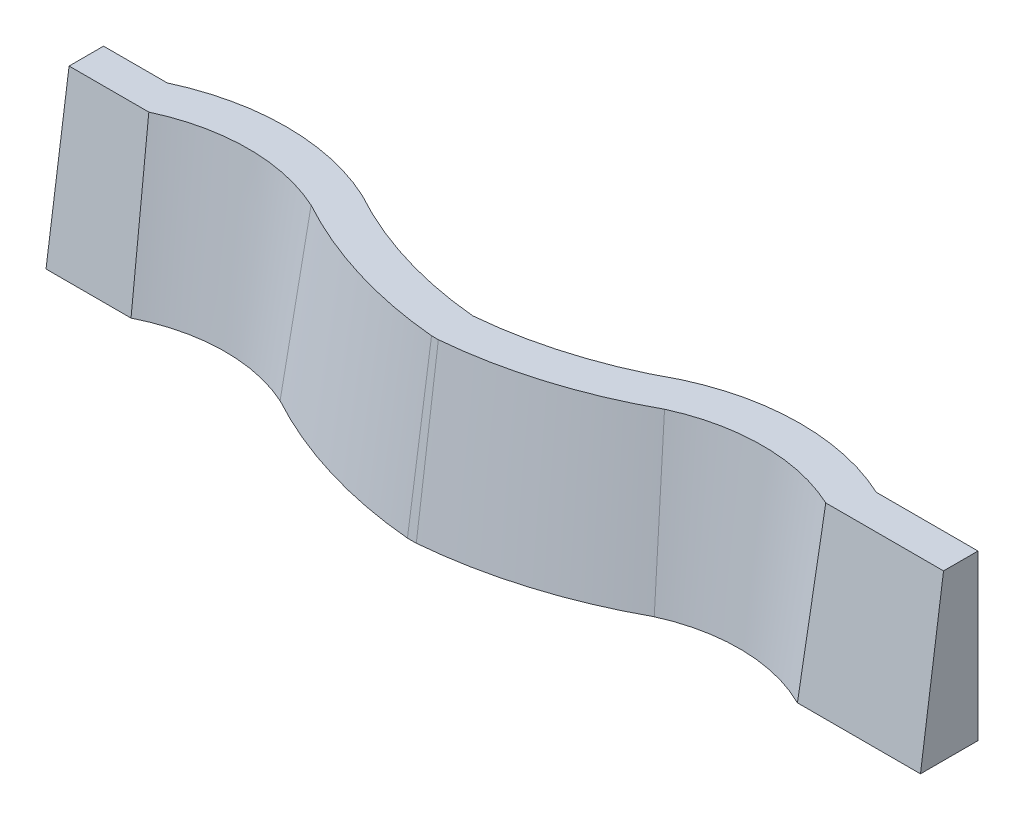
from build123d import *

# Parameters (mm, degrees)
BOSS_EXTRUDE1_DEPTH = 43.2
DRAFT2_ANGLE        = 8


with BuildPart() as part:
    # Sketch3 → Boss-Extrude1 (new body)
    with BuildSketch(Plane(origin=(0, 24, 0), x_dir=(1, 0, 0), z_dir=(0, 1, 0))):
        with BuildLine():
            Line((-0.896175087, -52.835898714), (0.896175087, -52.835898714))
            ThreePointArc((0.896175087, -52.835898714), (24.408925383, -48.242362776), (46.481310912, -38.927868909))
            ThreePointArc((46.481310912, -38.927868909), (67.768695813, -34.318589585), (89.02611517, -39.064148992))
            Line((89.02611517, -39.064148992), (120, -39.064148992))
            Line((120, -39.064148992), (120, -30))
            Line((120, -30), (93.25, -30))
            ThreePointArc((93.25, -30), (67.606257623, -24.318329423), (41.962515246, -30))
            ThreePointArc((41.962515246, -30), (21.653208784, -38.627914511), (0, -42.876136156))
            ThreePointArc((0, -42.876136156), (-21.653208784, -38.627914511), (-41.962515246, -30))
            ThreePointArc((-41.962515246, -30), (-67.606257623, -24.318329423), (-93.25, -30))
            Line((-93.25, -30), (-110, -30))
            Line((-110, -30), (-110, -39.064148992))
            Line((-110, -39.064148992), (-89.02611517, -39.064148992))
            ThreePointArc((-89.02611517, -39.064148992), (-67.768695813, -34.318589585), (-46.481310912, -38.927868909))
            ThreePointArc((-46.481310912, -38.927868909), (-24.408925383, -48.242362776), (-0.896175087, -52.835898714))
        make_face()
    extrude(amount=-BOSS_EXTRUDE1_DEPTH)

    # Draft2
    draft2_faces = [part.faces().sort_by_distance(p)[0] for p in [
        (0, 2.4, 52.835898714),
        (104.513057585, 2.4, 39.064148992),
        (67.768695813, 2.4, 34.318589585),
        (24.408925383, 2.4, 48.242362776),
        (-24.408925383, 2.4, 48.242362776),
        (-67.768695813, 2.4, 34.318589585),
        (-99.513057585, 2.4, 39.064148992),
    ]]
    draft(draft2_faces, Plane.ZX.offset(24), DRAFT2_ANGLE)


solid = part.part
